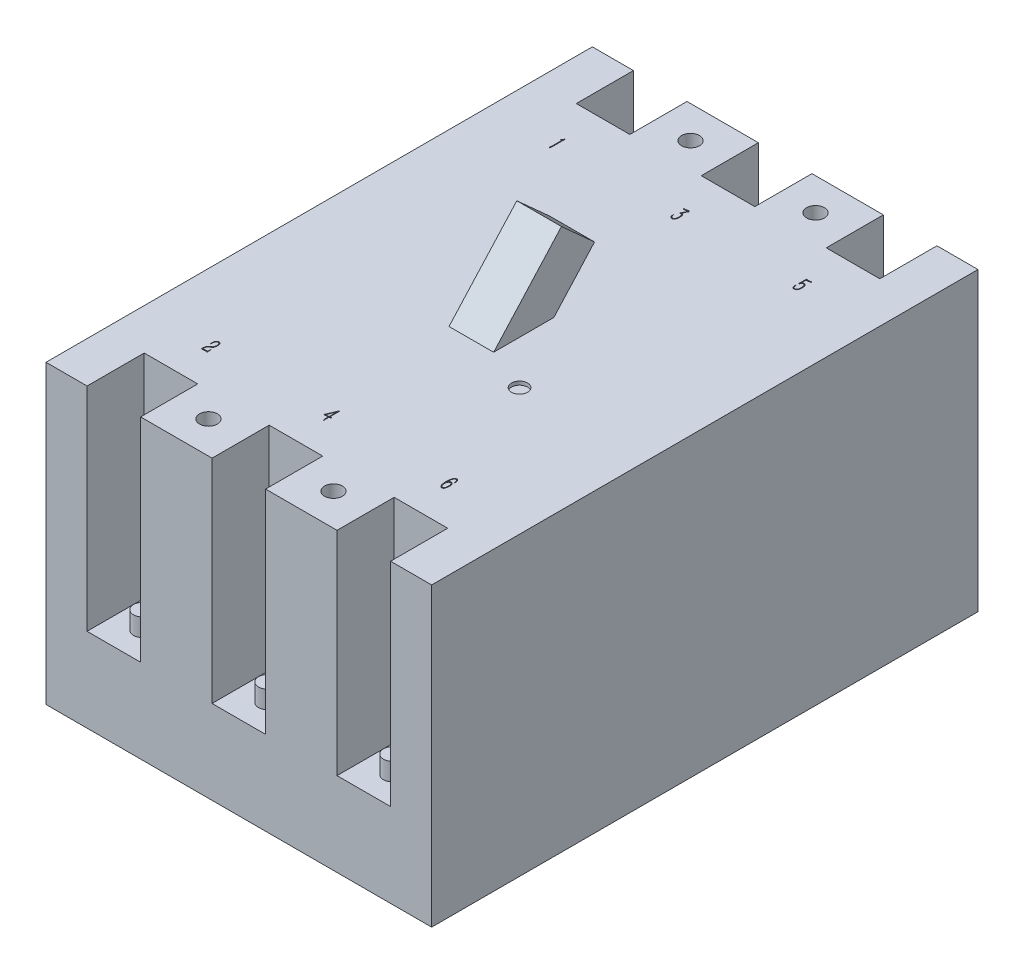
from build123d import *

# Parameters (mm, degrees)
SKETCH_1_W                 = 108
SKETCH_1_H                 = 153
EXTRUDE_1_DEPTH            = 83
SKETCH_31_R                = 2.5
CUT_EXTRUDE_2_DEPTH        = 138.062928959
SKETCH_4_W                 = 7.5
SKETCH_4_H                 = 16
SKETCH_4_W_2               = 15
CUT_EXTRUDE_3_DEPTH        = 59.5
SKETCH_33_R                = 2.5
EXTRUDE_2_DEPTH            = 5
MIRROR_2_COPY_1_SKETCH_W   = 7.5
MIRROR_2_COPY_1_SKETCH_H   = 16
MIRROR_2_COPY_1_SKETCH_W_2 = 15
MIRROR_2_COPY_1_DEPTH      = 59.5
MIRROR_2_COPY_2_SKETCH_R   = 2.5
MIRROR_2_COPY_2_DEPTH      = 5
EXTRUDE_3_DEPTH            = 6.25
CUT_EXTRUDE_4_DEPTH        = 1
SKETCH_37_R                = 2.252237749
CUT_EXTRUDE_6_DEPTH        = 1


with BuildPart() as part:
    # 草图1 → 凸台-拉伸1 (new body)
    with BuildSketch(Plane(origin=(0, 0, 0), x_dir=(1, 0, 0), z_dir=(0, 1, 0))):
        Rectangle(SKETCH_1_W, SKETCH_1_H)
    extrude(amount=EXTRUDE_1_DEPTH)

    # 草图31 → 切除-拉伸2 (cut, through all)
    with BuildSketch(Plane(origin=(-5.579690445, 0, -14.864692202), x_dir=(1, 0, 0), z_dir=(0, -1, 0))):
        with Locations(Location((23.079690445, -52.635307798, 0), (0, 0, 270))):
            Circle(SKETCH_31_R)
        with Locations(Location((-11.920309555, -52.635307798, 0), (0, 0, 270))):
            Circle(SKETCH_31_R)
        with Locations(Location((23.079690445, 82.364692202, 0), (0, 0, 270))):
            Circle(SKETCH_31_R)
        with Locations(Location((-11.920309555, 82.364692202, 0), (0, 0, 270))):
            Circle(SKETCH_31_R)
    extrude(amount=-CUT_EXTRUDE_2_DEPTH, mode=Mode.SUBTRACT)

    # 草图4 → 切除-拉伸3 (cut)
    with BuildSketch(Plane(origin=(0, 83, 0), x_dir=(1, 0, 0), z_dir=(0, 1, 0))):
        with Locations((3.75, 68.5)):
            Rectangle(SKETCH_4_W, SKETCH_4_H)
        with Locations((35, 68.5)):
            Rectangle(SKETCH_4_W_2, SKETCH_4_H)
    cut_extrude_3 = extrude(amount=-CUT_EXTRUDE_3_DEPTH, mode=Mode.SUBTRACT)

    # 草图33 → 凸台-拉伸2 (add)
    with BuildSketch(Plane(origin=(0, 23.5, 0), x_dir=(1, 0, 0), z_dir=(0, 1, 0))):
        with Locations(Location((35, 68.5, 0), (0, 0, 90))):
            Circle(SKETCH_33_R)
        with Locations((0, 68.5)):
            Circle(SKETCH_33_R)
    extrude_2 = extrude(amount=EXTRUDE_2_DEPTH)

    # 镜向1: 切除-拉伸3, 凸台-拉伸2 across plane
    add(cut_extrude_3.mirror(Plane(origin=(0, 0, 0), x_dir=(0, 0, 1), z_dir=(1, 0, 0))), mode=Mode.SUBTRACT)
    add(extrude_2.mirror(Plane(origin=(0, 0, 0), x_dir=(0, 0, 1), z_dir=(1, 0, 0))))

    # 镜向2: 切除-拉伸3, 凸台-拉伸2 across plane
    add(cut_extrude_3.mirror(Plane.XY), mode=Mode.SUBTRACT)
    add(extrude_2.mirror(Plane.XY))

    # 镜向2 copy 1 sketch → 镜向2 copy 1 (cut)
    with BuildSketch(Plane(origin=(0, 83, 0), x_dir=(-1, 0, 0), z_dir=(0, 1, 0))):
        with Locations((3.75, 68.5)):
            Rectangle(MIRROR_2_COPY_1_SKETCH_W, MIRROR_2_COPY_1_SKETCH_H)
        with Locations((35, 68.5)):
            Rectangle(MIRROR_2_COPY_1_SKETCH_W_2, MIRROR_2_COPY_1_SKETCH_H)
    extrude(amount=-MIRROR_2_COPY_1_DEPTH, mode=Mode.SUBTRACT)

    # 镜向2 copy 2 sketch → 镜向2 copy 2 (add)
    with BuildSketch(Plane(origin=(0, 23.5, 0), x_dir=(-1, 0, 0), z_dir=(0, 1, 0))):
        with Locations(Location((35, 68.5, 0), (0, 0, 90))):
            Circle(MIRROR_2_COPY_2_SKETCH_R)
        with Locations((0, 68.5)):
            Circle(MIRROR_2_COPY_2_SKETCH_R)
    extrude(amount=MIRROR_2_COPY_2_DEPTH)

    # 草图34 → 凸台-拉伸3 (add, symmetric)
    with BuildSketch(Plane(origin=(0, 0, 0), x_dir=(0, 0, -1), z_dir=(1, 0, 0))):
        Polygon((-11.393784787, 83), (7.595856524, 104), (16.867328691, 95.61609853), (5.458986509, 83), align=None)
    extrude(amount=EXTRUDE_3_DEPTH, both=True)

    # 草图36 → 切除-拉伸4 (cut)
    with BuildSketch(Plane(origin=(0, 83, 0), x_dir=(1, 0, 0), z_dir=(0, 1, 0))):
        with BuildLine():
            Line((-35.463855228, 50.271863997), (-35.390959416, 50.271863997))
            Line((-35.390959416, 50.271863997), (-35.397854965, 46.740357397))
            add(Edge.make_bspline(
                [(-35.397854965, 46.740357397), (-35.398640498, 46.70850869), (-35.400146669, 46.647442338), (-35.400268907, 46.560072226), (-35.403142299, 46.480966693), (-35.403371164, 46.410012482), (-35.405507773, 46.347302289), (-35.407978554, 46.292822989), (-35.408213325, 46.246472462), (-35.412583696, 46.173927907), (-35.417791571, 46.074184552), (-35.430706832, 45.971450592), (-35.440988352, 45.898248347), (-35.451440364, 45.864925406), (-35.46468199, 45.838559202), (-35.477897108, 45.841633988), (-35.483556799, 45.842950839)],
                knots=[0, 0, 0, 0, 1.45038606, 2.780953852, 3.977268029, 5.053718292, 6.010937745, 6.833690271, 7.536464333, 8.120251454, 10.142880859, 12.069479857, 12.873132744, 13.440417135, 13.76034519, 14, 14, 14, 14], degree=3))
            add(Edge.make_bspline(
                [(-35.483556799, 45.842950839), (-35.484865139, 45.843941163), (-35.490465154, 45.84817999), (-35.50381964, 45.857152029), (-35.519687524, 45.881202111), (-35.526633491, 45.902778266), (-35.53084057, 45.915846651)],
                knots=[0, 0, 0, 0, 0.221265066, 0.947068446, 2.150880552, 4, 4, 4, 4], degree=3))
            Line((-35.53084057, 45.915846651), (-35.563348162, 46.002533564))
            Line((-35.563348162, 46.002533564), (-35.637229053, 46.241907651))
            add(Edge.make_bspline(
                [(-35.637229053, 46.241907651), (-35.646122719, 46.264430286), (-35.661615025, 46.303663554), (-35.677243343, 46.355280368), (-35.689099513, 46.388239883), (-35.692250787, 46.414955004), (-35.677071085, 46.440013858), (-35.665891755, 46.478596853), (-35.648689753, 46.527845507), (-35.632445171, 46.585972264), (-35.618097373, 46.648777307), (-35.60517251, 46.716636181), (-35.597847619, 46.793090567), (-35.594254475, 46.866088454), (-35.591496951, 46.936370115), (-35.590995951, 47.004031777), (-35.589614127, 47.084145254), (-35.589829994, 47.141940196), (-35.589945283, 47.17280688)],
                knots=[0, 0, 0, 0, 1.220359697, 2.125803599, 2.712350858, 2.994193817, 3.439826662, 4.12562012, 5.031064022, 6.063176816, 7.167225426, 8.277459231, 9.542238136, 11.034069985, 11.961482632, 13.08703073, 14.444263491, 16, 16, 16, 16], degree=3))
            Line((-35.589945283, 47.17280688), (-35.584034811, 49.779324722))
            Line((-35.584034811, 49.779324722), (-35.929797382, 49.479860843))
            Line((-35.929797382, 49.479860843), (-35.956394503, 49.593144877))
            add(Edge.make_bspline(
                [(-35.956394503, 49.593144877), (-35.928288885, 49.622186554), (-35.875603746, 49.676626377), (-35.805193046, 49.755009937), (-35.747282709, 49.823034452), (-35.686965228, 49.902558297), (-35.619432928, 50.001525227), (-35.569562455, 50.08283406), (-35.543646591, 50.125087293)],
                knots=[0, 0, 0, 0, 1.077185482, 2.019228619, 2.808185376, 3.45765616, 4.678836699, 6, 6, 6, 6], degree=3))
            Line((-35.543646591, 50.125087293), (-35.463855228, 50.271863997))
        make_face()
        with BuildLine():
            add(Edge.make_bspline(
                [(-1.332996908, 48.655350097), (-1.31824086, 48.685897445), (-1.289815262, 48.744742917), (-1.24835386, 48.829743476), (-1.209674151, 48.907784655), (-1.176591328, 48.98020216), (-1.145743098, 49.045399434), (-1.118268756, 49.104074436), (-1.094529073, 49.156246349), (-1.069536201, 49.214168344), (-1.043614775, 49.274594425), (-1.018520658, 49.333780228), (-1.000271921, 49.376058011), (-0.990837286, 49.398423846), (-0.987234338, 49.406965031)],
                knots=[0, 0, 0, 0, 1.475873638, 2.843077615, 4.114458223, 5.26483622, 6.306479236, 7.252326145, 8.083448402, 8.799989154, 9.996708352, 10.943956596, 11.596712522, 12, 12, 12, 12], degree=3))
            Line((-0.987234338, 49.406965031), (-0.774457371, 49.972400118))
            add(Edge.make_bspline(
                [(-0.774457371, 49.972400118), (-0.820734865, 49.967871333), (-0.921710075, 49.957989748), (-1.050572238, 49.950143748), (-1.157716509, 49.94442999), (-1.231235798, 49.938269385), (-1.295613755, 49.932511244), (-1.33530131, 49.928130482), (-1.353683558, 49.926101426)],
                knots=[0, 0, 0, 0, 1.440114021, 3.142257811, 3.998086789, 4.76330671, 5.427195687, 6, 6, 6, 6], degree=3))
            Line((-1.353683558, 49.926101426), (-1.552669425, 49.892608756))
            add(Edge.make_bspline(
                [(-1.552669425, 49.892608756), (-1.561560651, 49.890739522), (-1.585818346, 49.885639741), (-1.630678314, 49.871713817), (-1.695284952, 49.854588145), (-1.744459411, 49.840504542), (-1.772341941, 49.832518964)],
                knots=[0, 0, 0, 0, 0.478461291, 1.305373098, 2.472113022, 4, 4, 4, 4], degree=3))
            Line((-1.772341941, 49.832518964), (-1.838342204, 49.805921843))
            Line((-1.838342204, 49.805921843), (-2.004820479, 50.052191481))
            add(Edge.make_bspline(
                [(-2.004820479, 50.052191481), (-2.011850302, 50.061833456), (-2.02385096, 50.078293337), (-2.033813644, 50.101190689), (-2.041208813, 50.117098031), (-2.034580743, 50.133116746), (-2.008371403, 50.130714712), (-1.988582953, 50.116665233), (-1.963307571, 50.10314783), (-1.934227678, 50.10124669), (-1.89897255, 50.099177697), (-1.87313363, 50.103193566), (-1.859028854, 50.105385722)],
                knots=[0, 0, 0, 0, 1.323589942, 2.259509366, 2.829398404, 3.190947808, 3.965341466, 5.19662492, 6.050472624, 7.088782, 8.410843841, 10, 10, 10, 10], degree=3))
            Line((-1.859028854, 50.105385722), (-1.646251887, 50.112281272))
            Line((-1.646251887, 50.112281272), (-0.807950042, 50.211774206))
            Line((-0.807950042, 50.211774206), (-0.741949779, 50.271863997))
            Line((-0.741949779, 50.271863997), (-0.688755537, 50.325058239))
            add(Edge.make_bspline(
                [(-0.688755537, 50.325058239), (-0.687105827, 50.323094488), (-0.680342934, 50.315044202), (-0.665783636, 50.295888144), (-0.639895166, 50.265111371), (-0.620322331, 50.239463651), (-0.608964175, 50.224580227)],
                knots=[0, 0, 0, 0, 0.23984028, 0.983211964, 2.249351781, 4, 4, 4, 4], degree=3))
            Line((-0.608964175, 50.224580227), (-0.481889042, 50.064997502))
            add(Edge.make_bspline(
                [(-0.481889042, 50.064997502), (-0.473355746, 50.053918159), (-0.45917476, 50.035506048), (-0.448654159, 50.006059781), (-0.459434557, 49.986109256), (-0.474494123, 49.969008037), (-0.498905759, 49.948468162), (-0.518247228, 49.934175211), (-0.529172812, 49.926101426)],
                knots=[0, 0, 0, 0, 1.419029252, 2.358201718, 2.827787952, 3.596253847, 4.642174893, 6, 6, 6, 6], degree=3))
            Line((-0.529172812, 49.926101426), (-0.602068625, 49.866011635))
            add(Edge.make_bspline(
                [(-0.602068625, 49.866011635), (-0.623371993, 49.812473244), (-0.663792143, 49.710891665), (-0.722029572, 49.566323531), (-0.775319198, 49.437781678), (-0.822111181, 49.324143501), (-0.865090277, 49.226700605), (-0.90057206, 49.144017925), (-0.932517213, 49.077683042), (-0.952056541, 49.038851951), (-0.960637217, 49.021799318)],
                knots=[0, 0, 0, 0, 1.507300768, 2.859891598, 4.076963614, 5.147345159, 6.074452096, 6.862861548, 7.500626815, 8, 8, 8, 8], degree=3))
            Line((-0.960637217, 49.021799318), (-1.160608162, 48.642544076))
            add(Edge.make_bspline(
                [(-1.160608162, 48.642544076), (-1.136970953, 48.644431367), (-1.091701527, 48.648045862), (-1.022614792, 48.654945758), (-0.947340823, 48.645455013), (-0.881319042, 48.619050427), (-0.82514603, 48.58646919), (-0.780134585, 48.553926938), (-0.737132938, 48.511631119), (-0.693284476, 48.461909292), (-0.649333585, 48.402563713), (-0.608931526, 48.33068403), (-0.566873499, 48.248603861), (-0.51427509, 48.123514998), (-0.45744027, 47.956143546), (-0.422908357, 47.745924068), (-0.405846949, 47.535305771), (-0.403342212, 47.395138948), (-0.402097679, 47.325494056)],
                knots=[0, 0, 0, 0, 0.660541429, 1.265053373, 1.928435853, 2.750244091, 3.225390118, 3.735570922, 4.291687282, 4.900607759, 5.580848831, 6.342918567, 7.193367346, 8.147740655, 10.119512469, 12.097611575, 14.061014616, 16, 16, 16, 16], degree=3))
            add(Edge.make_bspline(
                [(-0.402097679, 47.325494056), (-0.404726648, 47.270969543), (-0.409720845, 47.167390476), (-0.421790637, 47.021025307), (-0.439802287, 46.892617688), (-0.466033174, 46.747849231), (-0.512293263, 46.587908576), (-0.569441733, 46.44034855), (-0.623703344, 46.33403995), (-0.669433819, 46.263547372), (-0.719521734, 46.200482752), (-0.773347731, 46.145294374), (-0.829337874, 46.099941108), (-0.883678867, 46.060935813), (-0.938666436, 46.033368138), (-1.009852767, 46.010338071), (-1.096844164, 45.994463304), (-1.16612907, 45.991282865), (-1.200011304, 45.989727543)],
                knots=[0, 0, 0, 0, 1.512752116, 2.8737433, 4.067977017, 5.104892351, 6.948544146, 8.672095895, 9.482011449, 10.251829035, 10.996496654, 11.710742831, 12.38300564, 12.991319199, 13.561044299, 14.079002633, 15.060579187, 16, 16, 16, 16], degree=3))
            add(Edge.make_bspline(
                [(-1.200011304, 45.989727543), (-1.228911408, 45.989234927), (-1.284511892, 45.988287192), (-1.365158936, 45.994852477), (-1.438610662, 46.009879213), (-1.507496182, 46.030320787), (-1.572009705, 46.062646769), (-1.633632597, 46.108824313), (-1.695667091, 46.165686645), (-1.755145754, 46.235467117), (-1.809581437, 46.315412429), (-1.857178565, 46.403842866), (-1.896725225, 46.499506512), (-1.936039594, 46.635649033), (-1.969361855, 46.809735263), (-1.975298306, 46.95067488), (-1.978223358, 47.020119705)],
                knots=[0, 0, 0, 0, 0.828828519, 1.594571005, 2.314948186, 2.97625877, 3.650192192, 4.371738268, 5.178272596, 6.059897072, 6.995131469, 7.947518938, 8.935744196, 9.957858231, 12.008325587, 14, 14, 14, 14], degree=3))
            Line((-1.978223358, 47.020119705), (-1.985118908, 47.279195364))
            Line((-1.985118908, 47.279195364), (-1.912223095, 47.279195364))
            add(Edge.make_bspline(
                [(-1.912223095, 47.279195364), (-1.906648849, 47.240776505), (-1.895973673, 47.167200983), (-1.880445403, 47.061050202), (-1.864362325, 46.964286574), (-1.846237148, 46.849776063), (-1.816050244, 46.721193109), (-1.765194515, 46.582804286), (-1.696227024, 46.46587446), (-1.615250698, 46.36951626), (-1.52054406, 46.299574509), (-1.419159036, 46.255456704), (-1.315829395, 46.234626171), (-1.247366821, 46.23488514), (-1.213802404, 46.235012101)],
                knots=[0, 0, 0, 0, 0.994021113, 1.903638599, 2.746793397, 3.505624798, 4.871908371, 6.122639036, 7.264652637, 8.331625701, 9.323760524, 10.250011688, 11.142051883, 12, 12, 12, 12], degree=3))
            add(Edge.make_bspline(
                [(-1.213802404, 46.235012101), (-1.186800334, 46.237340561), (-1.133914514, 46.241901044), (-1.057224335, 46.259263285), (-0.986301345, 46.288888617), (-0.920002445, 46.326772965), (-0.860326821, 46.376175459), (-0.806618438, 46.434387727), (-0.761134308, 46.503542507), (-0.71015941, 46.609414479), (-0.660619633, 46.755372977), (-0.623344885, 46.940765815), (-0.599089597, 47.129871431), (-0.587694594, 47.318030592), (-0.586141966, 47.503400035), (-0.601384421, 47.624718565), (-0.608964175, 47.685047726)],
                knots=[0, 0, 0, 0, 0.647840119, 1.268849254, 1.871153999, 2.479976942, 3.088343857, 3.716462885, 4.367721208, 5.059616847, 6.52246665, 8.039623249, 9.575767262, 11.078710543, 12.547304005, 14, 14, 14, 14], degree=3))
            add(Edge.make_bspline(
                [(-0.608964175, 47.685047726), (-0.619562912, 47.750073671), (-0.640514176, 47.878614997), (-0.688978495, 48.032902255), (-0.736702332, 48.148112138), (-0.779280281, 48.225408799), (-0.827540526, 48.294453007), (-0.882207105, 48.352361404), (-0.937623681, 48.399881624), (-0.993247145, 48.431590681), (-1.048178248, 48.447907478), (-1.083376846, 48.444320143), (-1.100518371, 48.442573131)],
                knots=[0, 0, 0, 0, 2.019199264, 3.991492233, 4.943861116, 5.841091039, 6.693606335, 7.520378909, 8.278781735, 8.923571305, 9.475785111, 10, 10, 10, 10], degree=3))
            Line((-1.100518371, 48.442573131), (-1.206906854, 48.42976711))
            Line((-1.206906854, 48.42976711), (-1.253205546, 48.343080197))
            add(Edge.make_bspline(
                [(-1.253205546, 48.343080197), (-1.259385174, 48.332276849), (-1.270157784, 48.313443961), (-1.284878439, 48.288551126), (-1.296635643, 48.273970818), (-1.305559628, 48.261401523), (-1.318459991, 48.265629851), (-1.326757526, 48.280078585), (-1.3400219, 48.301349147), (-1.348650254, 48.319617455), (-1.353683558, 48.330274176)],
                knots=[0, 0, 0, 0, 1.659028505, 2.892093886, 3.763458346, 4.288089223, 4.647361994, 5.327919393, 6.441255868, 8, 8, 8, 8], degree=3))
            Line((-1.353683558, 48.330274176), (-1.460072041, 48.536155593))
            add(Edge.make_bspline(
                [(-1.460072041, 48.536155593), (-1.467762008, 48.547988328), (-1.481167812, 48.568616159), (-1.475356033, 48.592130175), (-1.472878062, 48.602155856)],
                knots=[0, 0, 0, 0, 1.147259222, 2, 2, 2, 2], degree=3))
            Line((-1.472878062, 48.602155856), (-1.419683821, 48.622842505))
            Line((-1.419683821, 48.622842505), (-1.332996908, 48.655350097))
        make_face()
        with BuildLine():
            add(Edge.make_bspline(
                [(32.518099103, 50.03248991), (32.53358809, 50.034123241), (32.56042479, 50.036953203), (32.586756348, 50.042816624), (32.597890466, 50.045295931)],
                knots=[0, 0, 0, 0, 1.154313806, 2, 2, 2, 2], degree=3))
            Line((32.597890466, 50.045295931), (32.73777162, 50.052191481))
            Line((32.73777162, 50.052191481), (32.996847278, 50.091594623))
            Line((32.996847278, 50.091594623), (33.216519795, 50.118191743))
            add(Edge.make_bspline(
                [(33.216519795, 50.118191743), (33.23704136, 50.121509448), (33.280170582, 50.128482115), (33.321136278, 50.143704881), (33.342609849, 50.151684414)],
                knots=[0, 0, 0, 0, 0.951631555, 2, 2, 2, 2], degree=3))
            Line((33.342609849, 50.151684414), (33.442102783, 50.192072635))
            add(Edge.make_bspline(
                [(33.442102783, 50.192072635), (33.452340172, 50.195871744), (33.470301405, 50.202537181), (33.493217179, 50.213018793), (33.50971844, 50.219720396), (33.518609614, 50.223269234), (33.521894145, 50.224580227)],
                knots=[0, 0, 0, 0, 1.520021181, 2.666837392, 3.507509911, 4, 4, 4, 4], degree=3))
            Line((33.521894145, 50.224580227), (33.581983937, 50.264968447))
            Line((33.581983937, 50.264968447), (33.775059333, 50.071893052))
            add(Edge.make_bspline(
                [(33.775059333, 50.071893052), (33.782294889, 50.062227227), (33.794962128, 50.045305334), (33.79965252, 50.016324191), (33.793467356, 49.995265167), (33.78641201, 49.976731265), (33.766479612, 49.965565681), (33.750897282, 49.965527457), (33.741566662, 49.965504568)],
                knots=[0, 0, 0, 0, 1.452844315, 2.54348448, 3.406058373, 4.120848162, 4.874773518, 6, 6, 6, 6], degree=3))
            Line((33.741566662, 49.965504568), (32.504308004, 49.793115822))
            Line((32.504308004, 49.793115822), (32.484606433, 48.442573131))
            add(Edge.make_bspline(
                [(32.484606433, 48.442573131), (32.50978426, 48.47318708), (32.556228095, 48.529658559), (32.625254383, 48.610545492), (32.705471798, 48.679259807), (32.787820269, 48.723627751), (32.865033057, 48.755100064), (32.933444858, 48.771121004), (33.009018254, 48.781198048), (33.061825504, 48.782003805), (33.089444662, 48.78242523)],
                knots=[0, 0, 0, 0, 1.30943776, 2.415431215, 3.508265892, 4.775479805, 5.486396256, 6.257089544, 7.088425914, 8, 8, 8, 8], degree=3))
            add(Edge.make_bspline(
                [(33.089444662, 48.78242523), (33.116758479, 48.780655331), (33.168386924, 48.777309875), (33.240371885, 48.764586897), (33.302877274, 48.746671535), (33.374208067, 48.709955743), (33.457550996, 48.646383591), (33.536117538, 48.568676253), (33.597269505, 48.493379266), (33.642355, 48.428680001), (33.679839045, 48.354669005), (33.715600145, 48.2749978), (33.747458473, 48.187593681), (33.773761602, 48.091692419), (33.795266776, 47.987355976), (33.817362017, 47.833716507), (33.836894968, 47.625758514), (33.839632696, 47.454921968), (33.841059595, 47.365882276)],
                knots=[0, 0, 0, 0, 0.737858689, 1.39469691, 1.969129469, 2.484137971, 3.548991738, 4.782985237, 5.456749125, 6.164369648, 6.905359031, 7.690566505, 8.520047268, 9.411980184, 10.370982938, 11.392008999, 13.598323608, 16, 16, 16, 16], degree=3))
            add(Edge.make_bspline(
                [(33.841059595, 47.365882276), (33.839466481, 47.326149759), (33.836384756, 47.249291083), (33.831124341, 47.137873383), (33.822017597, 47.034432378), (33.807999132, 46.910043336), (33.786279251, 46.767552138), (33.748137976, 46.609517829), (33.695606461, 46.463896974), (33.62543521, 46.332767124), (33.546037814, 46.21823091), (33.461061306, 46.126696955), (33.373353011, 46.060129533), (33.279908223, 46.018196839), (33.177890759, 45.999464738), (33.10723839, 45.996964757), (33.069743091, 45.995638014)],
                knots=[0, 0, 0, 0, 0.953497838, 1.844448518, 2.674189816, 3.442807412, 4.845957472, 6.127295929, 7.335424679, 8.547012004, 9.682888764, 10.668703604, 11.530079681, 12.305522429, 13.100738679, 14, 14, 14, 14], degree=3))
            add(Edge.make_bspline(
                [(33.069743091, 45.995638014), (33.024753156, 45.994860363), (32.94130992, 45.993418047), (32.821377605, 46.007758352), (32.712583445, 46.047129539), (32.609115822, 46.107254371), (32.512432837, 46.191954607), (32.429166668, 46.2956999), (32.362724281, 46.407847287), (32.314596949, 46.524874595), (32.285145759, 46.651220386), (32.260028435, 46.788786537), (32.243192541, 46.934358152), (32.244565939, 47.032559691), (32.245232345, 47.080209497)],
                knots=[0, 0, 0, 0, 1.038316962, 1.925775792, 2.769505923, 3.689817589, 4.672983852, 5.718137725, 6.747565775, 7.672204827, 8.626195073, 9.735182009, 10.901054531, 12, 12, 12, 12], degree=3))
            Line((32.245232345, 47.080209497), (32.252127895, 47.266389343))
            Line((32.252127895, 47.266389343), (32.325023708, 47.266389343))
            add(Edge.make_bspline(
                [(32.325023708, 47.266389343), (32.328058338, 47.229263947), (32.334059271, 47.155849082), (32.347473694, 47.045829854), (32.369284997, 46.934172952), (32.395862871, 46.821204569), (32.430820571, 46.714632342), (32.468051649, 46.616280258), (32.52129409, 46.526770422), (32.586006518, 46.437243366), (32.669314465, 46.354606816), (32.752320448, 46.297351273), (32.82825101, 46.264679358), (32.893132955, 46.246760986), (32.965721219, 46.237578105), (33.016526208, 46.235894331), (33.04314597, 46.235012101)],
                knots=[0, 0, 0, 0, 1.11825376, 2.211328589, 3.324923754, 4.532299777, 5.691974021, 6.691431964, 7.680579644, 8.808308283, 10.000254076, 11.186807161, 11.80939407, 12.474247533, 13.200567339, 14, 14, 14, 14], degree=3))
            add(Edge.make_bspline(
                [(33.04314597, 46.235012101), (33.074424497, 46.235140402), (33.137537078, 46.235399281), (33.216842227, 46.254221166), (33.279280533, 46.283899056), (33.327673726, 46.318694296), (33.37822462, 46.362911207), (33.427039564, 46.418973517), (33.474612129, 46.481314026), (33.516547345, 46.549659222), (33.550075109, 46.623250726), (33.58542269, 46.72921835), (33.618263387, 46.872762414), (33.648372793, 47.057560677), (33.664052822, 47.259557562), (33.662552501, 47.399682637), (33.661775299, 47.47227076)],
                knots=[0, 0, 0, 0, 0.849390509, 1.713866746, 2.18933602, 2.722107664, 3.329685584, 4.012931591, 4.740083059, 5.461671267, 6.189151886, 6.934940173, 8.497098365, 10.188936476, 12.025778447, 14, 14, 14, 14], degree=3))
            add(Edge.make_bspline(
                [(33.661775299, 47.47227076), (33.659565655, 47.514662466), (33.655345264, 47.595630053), (33.642752968, 47.711143529), (33.629849346, 47.815144123), (33.607558963, 47.936746957), (33.571403209, 48.075822043), (33.519638249, 48.20484513), (33.469544547, 48.297998078), (33.428491162, 48.359797426), (33.381549272, 48.412587403), (33.330384419, 48.457244217), (33.274845702, 48.49284533), (33.216352141, 48.519994501), (33.15404771, 48.537207889), (33.111218604, 48.541081721), (33.089444662, 48.543051143)],
                knots=[0, 0, 0, 0, 1.343436322, 2.565945237, 3.677305729, 4.659990038, 6.477828082, 8.216935171, 9.044830502, 9.823221578, 10.559528994, 11.274319052, 11.966299338, 12.640726254, 13.308957145, 14, 14, 14, 14], degree=3))
            add(Edge.make_bspline(
                [(33.089444662, 48.543051143), (33.065755084, 48.542326077), (33.019704733, 48.540916615), (32.952635191, 48.529009606), (32.890503127, 48.508171393), (32.816116839, 48.471611734), (32.734612662, 48.417675138), (32.655399404, 48.343792401), (32.593361455, 48.26894064), (32.564948495, 48.21551025), (32.551591774, 48.190393022)],
                knots=[0, 0, 0, 0, 0.840347904, 1.633558669, 2.40744423, 3.157989381, 4.570423979, 5.856859538, 6.992525654, 8, 8, 8, 8], degree=3))
            Line((32.551591774, 48.190393022), (32.504308004, 48.09681056))
            Line((32.504308004, 48.09681056), (32.491501983, 48.011108726))
            add(Edge.make_bspline(
                [(32.491501983, 48.011108726), (32.490744979, 47.999337256), (32.489416008, 47.978671655), (32.484935561, 47.951141923), (32.482215074, 47.934172577), (32.479911421, 47.918807611), (32.464712904, 47.92067294), (32.44996839, 47.934490077), (32.4236479, 47.955719158), (32.403696379, 47.973875731), (32.392009049, 47.984511605)],
                knots=[0, 0, 0, 0, 1.417361355, 2.488272572, 3.242975776, 3.665551287, 3.979432497, 4.77388376, 6.110184861, 8, 8, 8, 8], degree=3))
            Line((32.392009049, 47.984511605), (32.252127895, 48.09681056))
            add(Edge.make_bspline(
                [(32.252127895, 48.09681056), (32.240138579, 48.107715116), (32.221527538, 48.124642281), (32.20108047, 48.15670327), (32.216294291, 48.190571267), (32.229814388, 48.211005164), (32.238336795, 48.223885693)],
                knots=[0, 0, 0, 0, 1.303116375, 2.022830373, 2.753688992, 4, 4, 4, 4], degree=3))
            Line((32.238336795, 48.223885693), (32.312217687, 48.323378626))
            Line((32.312217687, 48.323378626), (32.325023708, 49.034605339))
            Line((32.325023708, 49.034605339), (32.331919257, 49.546846185))
            add(Edge.make_bspline(
                [(32.331919257, 49.546846185), (32.331920027, 49.565891051), (32.331921684, 49.606936023), (32.331907188, 49.672607648), (32.331972658, 49.746489796), (32.331700483, 49.824634136), (32.332642712, 49.8998565), (32.329969346, 49.963858635), (32.328753654, 50.01318632), (32.326122028, 50.04070602), (32.325023708, 50.052191481)],
                knots=[0, 0, 0, 0, 0.904131945, 1.948560225, 3.117696361, 4.41154035, 5.658618894, 6.687930963, 7.452402571, 8, 8, 8, 8], degree=3))
            Line((32.325023708, 50.052191481), (32.298426587, 50.258072898))
            Line((32.298426587, 50.258072898), (32.365411928, 50.284670018))
            add(Edge.make_bspline(
                [(32.365411928, 50.284670018), (32.375168493, 50.260030344), (32.391572525, 50.218602848), (32.414607787, 50.163274986), (32.443648162, 50.121682227), (32.465878017, 50.09818933), (32.477710883, 50.085684151)],
                knots=[0, 0, 0, 0, 1.37928148, 2.31903137, 3.105226912, 4, 4, 4, 4], degree=3))
            Line((32.477710883, 50.085684151), (32.518099103, 50.03248991))
        make_face()
    extrude(amount=-CUT_EXTRUDE_4_DEPTH, mode=Mode.SUBTRACT)

    # 草图37 → 切除-拉伸6 (cut)
    # profile 1 of 4: a face of its own
    with BuildSketch(Plane(origin=(0, 83, 0), x_dir=(1, 0, 0), z_dir=(0, 1, 0))):
        with Locations(Location((18.452314292, -16.343478373, 0), (0, 0, 270))):
            Circle(SKETCH_37_R)
    # profile 2 of 4: a face of its own
    with BuildSketch(Plane(origin=(0, 83, 0), x_dir=(1, 0, 0), z_dir=(0, 1, 0))):
        with BuildLine():
            Line((-35.384268471, -48.977804096), (-35.484746483, -48.977804096))
            add(Edge.make_bspline(
                [(-35.484746483, -48.977804096), (-35.486816788, -48.945959396), (-35.490763661, -48.885249996), (-35.494836294, -48.798550386), (-35.496556187, -48.720704736), (-35.498279126, -48.625801767), (-35.495621921, -48.506117127), (-35.488487104, -48.409715778), (-35.484746483, -48.359174767)],
                knots=[0, 0, 0, 0, 0.927540379, 1.768282303, 2.522502339, 3.190652681, 4.527123766, 6, 6, 6, 6], degree=3))
            add(Edge.make_bspline(
                [(-35.484746483, -48.359174767), (-35.48215774, -48.32170718), (-35.477151408, -48.249249161), (-35.463938945, -48.144819481), (-35.44864812, -48.04804826), (-35.4287686, -47.957027781), (-35.401908093, -47.867955151), (-35.363669256, -47.778363435), (-35.315978221, -47.685184014), (-35.259632531, -47.5916785), (-35.197808003, -47.503448543), (-35.128412535, -47.431650793), (-35.055784535, -47.376926412), (-34.978510068, -47.344357066), (-34.904315385, -47.324103579), (-34.836655914, -47.308172054), (-34.77585512, -47.297038071), (-34.737441206, -47.295849834), (-34.71934045, -47.295289933)],
                knots=[0, 0, 0, 0, 1.238521709, 2.395159043, 3.470603583, 4.46912877, 5.466066804, 6.534123646, 7.677244524, 8.916145015, 10.13365226, 11.221244199, 12.198275335, 13.109907183, 13.966820176, 14.733954848, 15.403435577, 16, 16, 16, 16], degree=3))
            add(Edge.make_bspline(
                [(-34.71934045, -47.295289933), (-34.696272875, -47.296990767), (-34.650692059, -47.300351563), (-34.583643941, -47.315923052), (-34.518889222, -47.338374814), (-34.43606575, -47.378370168), (-34.339217031, -47.441077368), (-34.256824574, -47.523422307), (-34.199811333, -47.598798329), (-34.159651096, -47.662949152), (-34.124062788, -47.734582465), (-34.079370384, -47.838668107), (-34.032615915, -47.976790702), (-33.998898981, -48.151240495), (-33.977280515, -48.332398841), (-33.967389377, -48.517597226), (-33.965550227, -48.700970271), (-33.976317441, -48.820563197), (-33.981516617, -48.878311162)],
                knots=[0, 0, 0, 0, 0.570779476, 1.127842599, 1.694919432, 2.261066821, 3.397481896, 4.527710891, 5.118384485, 5.730727279, 6.394748858, 7.092559246, 8.529363642, 9.986910621, 11.474321506, 13.03467297, 14.568129345, 16, 16, 16, 16], degree=3))
            add(Edge.make_bspline(
                [(-33.981516617, -48.878311162), (-33.992056171, -48.937712738), (-34.01329253, -49.057402171), (-34.059033138, -49.201506597), (-34.10169144, -49.311063099), (-34.137356019, -49.384477115), (-34.17546327, -49.449468975), (-34.230566126, -49.52632829), (-34.314715385, -49.613572204), (-34.392693403, -49.672078982), (-34.433667671, -49.702821908)],
                knots=[0, 0, 0, 0, 1.490916612, 3.004077927, 3.729534125, 4.397912905, 5.020560084, 5.590839424, 6.734084393, 8, 8, 8, 8], degree=3))
            Line((-34.433667671, -49.702821908), (-34.759728671, -49.908703325))
            add(Edge.make_bspline(
                [(-34.759728671, -49.908703325), (-34.801278643, -49.936911078), (-34.880065318, -49.990398362), (-34.985267282, -50.077767325), (-35.073566739, -50.16982537), (-35.140308074, -50.271614332), (-35.1921447, -50.376391782), (-35.238173974, -50.481598586), (-35.272923736, -50.597560698), (-35.297639118, -50.701500803), (-35.31449419, -50.788794854), (-35.322937234, -50.849675587), (-35.329796063, -50.903482724), (-35.330665993, -50.937107354), (-35.33107423, -50.952886587)],
                knots=[0, 0, 0, 0, 1.453572249, 2.75625039, 3.953730064, 5.132566341, 6.263730064, 7.337486329, 8.453238547, 9.76321854, 10.430854957, 11.026567013, 11.543191201, 12, 12, 12, 12], degree=3))
            Line((-35.33107423, -50.952886587), (-35.344865329, -51.231663817))
            Line((-35.344865329, -51.231663817), (-34.154890441, -51.192260675))
            add(Edge.make_bspline(
                [(-34.154890441, -51.192260675), (-34.139621053, -51.191406924), (-34.11280194, -51.189907399), (-34.087027126, -51.161808455), (-34.08128995, -51.127499624), (-34.071109689, -51.085300748), (-34.063541362, -51.024812425), (-34.057702927, -50.978812049), (-34.054412429, -50.952886587)],
                knots=[0, 0, 0, 0, 0.925905201, 1.626257371, 2.181371879, 3.087088273, 4.358305093, 6, 6, 6, 6], degree=3))
            Line((-34.054412429, -50.952886587), (-34.027815309, -50.3736604))
            Line((-34.027815309, -50.3736604), (-33.935217925, -50.3736604))
            Line((-33.935217925, -50.3736604), (-33.901725254, -51.251365388))
            add(Edge.make_bspline(
                [(-33.901725254, -51.251365388), (-33.900605576, -51.268428929), (-33.898647258, -51.298273081), (-33.897693975, -51.33775258), (-33.897666993, -51.365242792), (-33.898082756, -51.38743835), (-33.905231445, -51.406844344), (-33.911874014, -51.429361685), (-33.937786056, -51.442082922), (-33.975032777, -51.446153158), (-34.031639511, -51.45191771), (-34.076067408, -51.451549018), (-34.1016962, -51.451336333)],
                knots=[0, 0, 0, 0, 1.385018147, 2.4223982, 3.193529914, 3.619812046, 4.200562765, 4.878496499, 5.402948042, 6.404258339, 7.925751149, 10, 10, 10, 10], degree=3))
            Line((-34.1016962, -51.451336333), (-35.424656692, -51.484829004))
            add(Edge.make_bspline(
                [(-35.424656692, -51.484829004), (-35.440738616, -51.484876051), (-35.472437276, -51.484968785), (-35.504920922, -51.453448063), (-35.518556888, -51.414860573), (-35.525381634, -51.369473941), (-35.529953012, -51.309260908), (-35.53214882, -51.20569819), (-35.527454252, -51.058344357), (-35.516879873, -50.936754306), (-35.511343604, -50.873095225)],
                knots=[0, 0, 0, 0, 0.556373901, 1.096654043, 1.476064089, 2.012759395, 2.73145082, 3.635924119, 5.715166189, 8, 8, 8, 8], degree=3))
            add(Edge.make_bspline(
                [(-35.511343604, -50.873095225), (-35.506430625, -50.835937505), (-35.496966521, -50.764358837), (-35.477723783, -50.661325), (-35.457207904, -50.565686534), (-35.434942761, -50.477501301), (-35.410363137, -50.397233881), (-35.383534547, -50.324976165), (-35.355722578, -50.259564412), (-35.313947559, -50.185566601), (-35.260854761, -50.104906496), (-35.20046462, -50.017935485), (-35.142320675, -49.944160713), (-35.066323705, -49.862996572), (-34.963438357, -49.774405104), (-34.87700812, -49.709536234), (-34.832624484, -49.676224787)],
                knots=[0, 0, 0, 0, 1.103491021, 2.125706759, 3.085324024, 3.98349739, 4.803138144, 5.555704107, 6.252741852, 6.89323317, 8.054555834, 9.09539633, 10.010480884, 10.817709087, 12.365830683, 14, 14, 14, 14], degree=3))
            Line((-34.832624484, -49.676224787), (-34.559757725, -49.502850963))
            add(Edge.make_bspline(
                [(-34.559757725, -49.502850963), (-34.537911822, -49.488326478), (-34.495989802, -49.460454172), (-34.438086588, -49.416079198), (-34.388721927, -49.370037007), (-34.34618107, -49.320351469), (-34.307670968, -49.262858257), (-34.276044136, -49.191193868), (-34.242608839, -49.106780118), (-34.203625137, -48.975448095), (-34.163430125, -48.802101373), (-34.1480216, -48.587924669), (-34.156252973, -48.370970372), (-34.181417832, -48.226971329), (-34.194293583, -48.15329335)],
                knots=[0, 0, 0, 0, 0.635613896, 1.219735276, 1.765761318, 2.268061313, 2.802129131, 3.435697723, 4.161225462, 5.001884758, 6.75303811, 8.46119913, 10.189351173, 12, 12, 12, 12], degree=3))
            add(Edge.make_bspline(
                [(-34.194293583, -48.15329335), (-34.203995681, -48.115732349), (-34.222917992, -48.042475924), (-34.258732486, -47.936947188), (-34.305092154, -47.840834152), (-34.354713194, -47.751049817), (-34.416878977, -47.672457503), (-34.499684737, -47.616012587), (-34.597508507, -47.578280464), (-34.669064129, -47.571636055), (-34.706534429, -47.568156691)],
                knots=[0, 0, 0, 0, 1.101106684, 2.147523679, 3.156537618, 4.125318695, 5.058520457, 5.968677808, 6.93629249, 8, 8, 8, 8], degree=3))
            add(Edge.make_bspline(
                [(-34.706534429, -47.568156691), (-34.726257879, -47.567954764), (-34.765597681, -47.567552007), (-34.82419258, -47.576437761), (-34.881184192, -47.595068764), (-34.956047857, -47.628836425), (-35.042554325, -47.691736438), (-35.133608892, -47.786640638), (-35.208714431, -47.902520732), (-35.266539943, -48.036804624), (-35.310020423, -48.189790586), (-35.345318061, -48.361246287), (-35.368495507, -48.553345993), (-35.37497089, -48.687801352), (-35.378358, -48.758131579)],
                knots=[0, 0, 0, 0, 0.469335518, 0.936122588, 1.403629858, 1.893624907, 2.887406355, 3.927357629, 5.011993806, 6.157121359, 7.396943717, 8.794309501, 10.323183677, 12, 12, 12, 12], degree=3))
            Line((-35.378358, -48.758131579), (-35.384268471, -48.977804096))
        make_face()
    # profile 3 of 4: a face of its own
    with BuildSketch(Plane(origin=(0, 83, 0), x_dir=(1, 0, 0), z_dir=(0, 1, 0))):
        with BuildLine():
            Line((-1.211435685, -50.247570346), (-2.149230465, -50.300764588))
            Line((-2.149230465, -50.300764588), (-2.215230727, -50.400257521))
            add(Edge.make_bspline(
                [(-2.215230727, -50.400257521), (-2.219537618, -50.410683646), (-2.226046665, -50.426440752), (-2.250112266, -50.442690901), (-2.268166249, -50.419381447), (-2.276697515, -50.404180177), (-2.282216069, -50.39434705)],
                knots=[0, 0, 0, 0, 1.282902353, 1.938863145, 2.666728425, 4, 4, 4, 4], degree=3))
            Line((-2.282216069, -50.39434705), (-2.408306123, -50.141181863))
            add(Edge.make_bspline(
                [(-2.408306123, -50.141181863), (-2.413700195, -50.126232022), (-2.422594963, -50.10157989), (-2.429070684, -50.068490733), (-2.427229466, -50.045153505), (-2.422955921, -50.033098734), (-2.421112144, -50.027897829)],
                knots=[0, 0, 0, 0, 1.63130738, 2.690008936, 3.434818089, 4, 4, 4, 4], degree=3))
            Line((-2.421112144, -50.027897829), (-2.367917903, -50.015091808))
            Line((-2.367917903, -50.015091808), (-2.29502209, -49.974703588))
            Line((-2.29502209, -49.974703588), (-1.171047465, -47.261797262))
            Line((-1.171047465, -47.261797262), (-1.02525584, -47.261797262))
            Line((-1.02525584, -47.261797262), (-1.02525584, -50.001300709))
            add(Edge.make_bspline(
                [(-1.02525584, -50.001300709), (-1.011556587, -50.00140457), (-0.988262648, -50.001581174), (-0.967020188, -49.992312443), (-0.958270498, -49.988494687)],
                knots=[0, 0, 0, 0, 1.176207474, 2, 2, 2, 2], degree=3))
            Line((-0.958270498, -49.988494687), (-0.858777565, -49.948106467))
            add(Edge.make_bspline(
                [(-0.858777565, -49.948106467), (-0.8459156, -49.943306049), (-0.822989557, -49.934749457), (-0.793469311, -49.921899019), (-0.772571805, -49.912004766), (-0.762834561, -49.904532102), (-0.759284631, -49.901807775)],
                knots=[0, 0, 0, 0, 1.495147538, 2.665053038, 3.513315187, 4, 4, 4, 4], degree=3))
            Line((-0.759284631, -49.901807775), (-0.712985939, -49.862404633))
            Line((-0.712985939, -49.862404633), (-0.526806094, -50.05449495))
            add(Edge.make_bspline(
                [(-0.526806094, -50.05449495), (-0.517321407, -50.065909105), (-0.501795361, -50.084593612), (-0.495018899, -50.116213396), (-0.501481251, -50.137596911), (-0.513561786, -50.152996075), (-0.534619393, -50.159451003), (-0.550119406, -50.160350105), (-0.559313686, -50.160883434)],
                knots=[0, 0, 0, 0, 1.690587597, 2.767423091, 3.557953073, 4.202677464, 4.933866242, 6, 6, 6, 6], degree=3))
            Line((-0.559313686, -50.160883434), (-1.02525584, -50.214077675))
            Line((-1.02525584, -50.214077675), (-1.02525584, -51.405037642))
            add(Edge.make_bspline(
                [(-1.02525584, -51.405037642), (-1.025279553, -51.40865006), (-1.025359357, -51.420807237), (-1.023829237, -51.446399645), (-1.023208781, -51.487121514), (-1.022410361, -51.537723555), (-1.021042987, -51.588498874), (-1.021484769, -51.6296242), (-1.024150455, -51.655558246), (-1.0304201, -51.672225173), (-1.042692733, -51.675209502), (-1.048992044, -51.672320795), (-1.05185296, -51.67100885)],
                knots=[0, 0, 0, 0, 0.375701713, 1.264380521, 2.665139726, 4.612257271, 6.525225464, 7.960129458, 8.858599367, 9.286556546, 9.675980055, 10, 10, 10, 10], degree=3))
            add(Edge.make_bspline(
                [(-1.05185296, -51.67100885), (-1.057414868, -51.667702925), (-1.074181438, -51.657737095), (-1.088876102, -51.625576279), (-1.106532696, -51.592195251), (-1.114470173, -51.568026035), (-1.117853223, -51.557724817)],
                knots=[0, 0, 0, 0, 0.572299195, 1.725216547, 3.030459198, 4, 4, 4, 4], degree=3))
            Line((-1.117853223, -51.557724817), (-1.177943015, -51.437545234))
            Line((-1.177943015, -51.437545234), (-1.211435685, -51.34494785))
            add(Edge.make_bspline(
                [(-1.211435685, -51.34494785), (-1.216528971, -51.33385142), (-1.225745373, -51.313772209), (-1.235841372, -51.286094368), (-1.244855544, -51.265660731), (-1.249873497, -51.241350933), (-1.243987287, -51.203374701), (-1.231014423, -51.15019247), (-1.215434698, -51.093339283), (-1.208114758, -51.041388178), (-1.205109704, -50.996602119), (-1.204732711, -50.967667123), (-1.204540136, -50.952886587)],
                knots=[0, 0, 0, 0, 0.908031708, 1.643101311, 2.192199313, 2.565975908, 3.473020803, 5.002279505, 6.661670863, 7.846934984, 8.900174221, 10, 10, 10, 10], degree=3))
            Line((-1.204540136, -50.952886587), (-1.211435685, -50.247570346))
        make_face()
        Polygon((-1.204540136, -50.027897829), (-1.204540136, -47.8203368), (-2.142334915, -50.0751816), align=None, mode=Mode.SUBTRACT)
    # profile 4 of 4: a face of its own
    with BuildSketch(Plane(origin=(0, 83, 0), x_dir=(1, 0, 0), z_dir=(0, 1, 0))):
        with BuildLine():
            Line((32.489544475, -48.525653041), (32.396947092, -48.525653041))
            add(Edge.make_bspline(
                [(32.396947092, -48.525653041), (32.390618138, -48.485974663), (32.378095963, -48.407468855), (32.366562613, -48.287504456), (32.352497129, -48.162850163), (32.328414505, -48.030954767), (32.290523393, -47.893828596), (32.237226445, -47.784815068), (32.186807484, -47.70313126), (32.143824693, -47.648507065), (32.094512729, -47.602751024), (32.041806554, -47.564230886), (31.985048934, -47.534449558), (31.925543789, -47.5129599), (31.862392262, -47.503345628), (31.798115068, -47.503951251), (31.735531037, -47.511240082), (31.677398756, -47.52639751), (31.624981758, -47.546916331), (31.576325572, -47.574086246), (31.531679104, -47.613375929), (31.485109988, -47.662612589), (31.438393843, -47.726793325), (31.389495401, -47.802599966), (31.342103936, -47.891143509), (31.300292036, -47.991935337), (31.26295454, -48.103567026), (31.219593113, -48.268538434), (31.179385603, -48.490049152), (31.155271801, -48.716679315), (31.143870366, -48.894671911), (31.138211895, -49.013899258), (31.133572281, -49.117320989), (31.133242534, -49.181054527), (31.133091313, -49.210282633)],
                knots=[0, 0, 0, 0, 1.172618578, 2.320089015, 3.517365984, 4.833421129, 6.231766425, 7.655217032, 8.357323983, 9.032478261, 9.676711985, 10.315215253, 10.932648665, 11.54199308, 12.153444918, 12.786093219, 13.413857257, 13.988112725, 14.53457488, 15.054145165, 15.605211832, 16.262994999, 17.029841423, 17.917944275, 18.895673466, 19.956732694, 21.09950916, 22.329492637, 24.933332206, 27.662278065, 28.97833321, 30.139613505, 31.146829503, 32, 32, 32, 32], degree=3))
            Line((31.133091313, -49.210282633), (31.127180841, -49.469358292))
            add(Edge.make_bspline(
                [(31.127180841, -49.469358292), (31.143624652, -49.422958894), (31.173347053, -49.339091381), (31.218982626, -49.223380697), (31.270656602, -49.125263301), (31.33089537, -49.034534705), (31.408848762, -48.950796672), (31.488482411, -48.889616892), (31.563362183, -48.847329011), (31.629857947, -48.823093711), (31.704727584, -48.806352511), (31.757546307, -48.801212298), (31.785213312, -48.7985198)],
                knots=[0, 0, 0, 0, 1.463710204, 2.645675197, 3.693667506, 4.755032446, 5.874045908, 7.078730407, 7.725382873, 8.423483439, 9.174203962, 10, 10, 10, 10], degree=3))
            add(Edge.make_bspline(
                [(31.785213312, -48.7985198), (31.825183871, -48.800048226), (31.901196845, -48.802954872), (32.010627922, -48.83567069), (32.112929376, -48.893079282), (32.191731865, -48.963274414), (32.255346379, -49.032548752), (32.302202341, -49.09598405), (32.347925457, -49.167738339), (32.40669714, -49.275257996), (32.4700724, -49.421890914), (32.515864643, -49.578577589), (32.539651222, -49.711335001), (32.555161502, -49.818344282), (32.563375085, -49.932549272), (32.568161098, -50.092210933), (32.565815419, -50.291489059), (32.554948535, -50.449876111), (32.549634267, -50.527332654)],
                knots=[0, 0, 0, 0, 0.909148716, 1.728949998, 2.576991438, 3.564625719, 4.121218537, 4.72026629, 5.360049571, 6.060456872, 7.512703724, 8.993852322, 9.770776208, 10.587253518, 11.458483217, 12.380006039, 14.229702395, 16, 16, 16, 16], degree=3))
            add(Edge.make_bspline(
                [(32.549634267, -50.527332654), (32.543426212, -50.567456686), (32.530550843, -50.650673038), (32.503269006, -50.779042069), (32.46980255, -50.91539477), (32.431354569, -51.054731487), (32.386836864, -51.187031668), (32.327940431, -51.29977653), (32.256710984, -51.388288904), (32.174409512, -51.449310743), (32.093128822, -51.489521532), (32.020434946, -51.520650699), (31.95716019, -51.543115906), (31.916683627, -51.54843802), (31.898497345, -51.550829267)],
                knots=[0, 0, 0, 0, 1.110217054, 2.302565578, 3.587623031, 4.949459538, 6.256081064, 7.397105523, 8.411240029, 9.334418742, 10.173869837, 10.886090718, 11.499516107, 12, 12, 12, 12], degree=3))
            add(Edge.make_bspline(
                [(31.898497345, -51.550829267), (31.865309525, -51.553611507), (31.799140795, -51.559158641), (31.715570239, -51.543977858), (31.64855278, -51.520581918), (31.594243554, -51.492621989), (31.533888459, -51.45875096), (31.471002264, -51.414521026), (31.40710819, -51.36307472), (31.349934216, -51.299514901), (31.297248554, -51.228558984), (31.236503903, -51.121189806), (31.172617082, -50.97872629), (31.113345076, -50.830809958), (31.075190205, -50.699927945), (31.049320154, -50.582701615), (31.024855967, -50.446632903), (31.003721683, -50.29831303), (30.985075735, -50.151761469), (30.96948966, -50.02035509), (30.956307054, -49.911089382), (30.944313173, -49.794954845), (30.935946107, -49.665856771), (30.933241452, -49.51368859), (30.93583117, -49.353418346), (30.939210885, -49.242457431), (30.941000995, -49.183685512)],
                knots=[0, 0, 0, 0, 0.848219995, 1.691151707, 2.144998995, 2.659153853, 3.249319417, 3.912736756, 4.621867519, 5.340468245, 6.090710837, 6.87657341, 8.487178015, 10.078339935, 10.944022033, 11.968008362, 13.14490399, 14.476453821, 15.796264219, 16.920399402, 17.85823784, 18.608902694, 19.903936842, 21.162934464, 22.497310667, 24, 24, 24, 24], degree=3))
            add(Edge.make_bspline(
                [(30.941000995, -49.183685512), (30.942186306, -49.136725542), (30.944416431, -49.04837188), (30.949463606, -48.924251445), (30.954677186, -48.817112645), (30.965832666, -48.694205203), (30.984211709, -48.543608461), (31.013192414, -48.359320063), (31.047194074, -48.174447362), (31.084261234, -48.025789508), (31.119929608, -47.912012776), (31.153455377, -47.824980592), (31.195592489, -47.735860973), (31.241368969, -47.64413346), (31.293644235, -47.556992767), (31.351209188, -47.478636587), (31.413343197, -47.412480504), (31.479854109, -47.356476976), (31.554929523, -47.3141669), (31.638712167, -47.284268431), (31.732423839, -47.268778475), (31.797639819, -47.268722095), (31.831512004, -47.268692812)],
                knots=[0, 0, 0, 0, 1.211628523, 2.279639787, 3.204225299, 3.977932759, 5.462339825, 7.116605252, 8.789327199, 10.30942825, 11.064792467, 11.863814246, 12.712679163, 13.606614715, 14.50718602, 15.330439464, 16.109367713, 16.843542067, 17.564206182, 18.319665359, 19.127259812, 20, 20, 20, 20], degree=3))
            add(Edge.make_bspline(
                [(31.831512004, -47.268692812), (31.865842467, -47.271534805), (31.930717508, -47.276905383), (32.020138881, -47.301254552), (32.096951734, -47.333586492), (32.157761068, -47.379417997), (32.205482477, -47.429958048), (32.249579794, -47.475864972), (32.284266033, -47.522382927), (32.314434765, -47.568013185), (32.339384232, -47.618675605), (32.364375091, -47.675967062), (32.387491152, -47.743389722), (32.409962344, -47.817124404), (32.430938349, -47.891367471), (32.448803386, -47.960311911), (32.462633792, -48.021085408), (32.47663253, -48.094395558), (32.488235567, -48.190692582), (32.489083197, -48.269816839), (32.489544475, -48.312876075)],
                knots=[0, 0, 0, 0, 1.358046768, 2.566331314, 3.646368544, 4.629682629, 5.546946845, 6.391627168, 7.141431054, 7.835891544, 8.549473584, 9.368770778, 10.304200405, 11.362836174, 12.414134618, 13.351720444, 14.176238426, 14.875889185, 16.299866179, 18, 18, 18, 18], degree=3))
            Line((32.489544475, -48.312876075), (32.489544475, -48.525653041))
        make_face()
        with BuildLine():
            add(Edge.make_bspline(
                [(31.212882675, -50.167778983), (31.214874381, -50.226950566), (31.218962006, -50.348389825), (31.2437999, -50.53257042), (31.286985073, -50.719430112), (31.338591517, -50.872548592), (31.38978496, -50.989580476), (31.435774604, -51.068617555), (31.485635475, -51.140634923), (31.542659567, -51.202476531), (31.605368597, -51.254993038), (31.677834481, -51.288066129), (31.756289538, -51.30755436), (31.810383227, -51.305581638), (31.838407554, -51.30455963)],
                knots=[0, 0, 0, 0, 1.4886747, 3.055242853, 4.666194597, 6.306608966, 7.112592917, 7.87485258, 8.603662743, 9.310999056, 9.986965693, 10.644668568, 11.297843225, 12, 12, 12, 12], degree=3))
            add(Edge.make_bspline(
                [(31.838407554, -51.30455963), (31.862575933, -51.302268739), (31.911017081, -51.297677063), (31.981361947, -51.272388854), (32.048994879, -51.234557384), (32.11246719, -51.182884869), (32.170128631, -51.121845292), (32.221449032, -51.054193609), (32.262923732, -50.979812496), (32.30627113, -50.87043499), (32.34625878, -50.72050108), (32.368253552, -50.527150296), (32.381794121, -50.32487429), (32.392235625, -50.116430924), (32.389870858, -49.900385159), (32.363944801, -49.75612191), (32.3506484, -49.682135259)],
                knots=[0, 0, 0, 0, 0.542441635, 1.087226227, 1.660703064, 2.273516638, 2.914006631, 3.539772715, 4.172601069, 4.816509057, 6.173746714, 7.636628278, 9.17189136, 10.71932084, 12.317475397, 14, 14, 14, 14], degree=3))
            add(Edge.make_bspline(
                [(32.3506484, -49.682135259), (32.33259882, -49.621455339), (32.29673454, -49.500885129), (32.228282592, -49.360624228), (32.164771081, -49.260452505), (32.117824691, -49.195120167), (32.065390248, -49.144770367), (32.01323155, -49.104169401), (31.958722065, -49.075816918), (31.90465655, -49.053797776), (31.848272737, -49.044281038), (31.810846495, -49.04396339), (31.792108862, -49.043804358)],
                knots=[0, 0, 0, 0, 2.076888393, 4.126750173, 5.096135134, 5.973977047, 6.759453719, 7.47553224, 8.136547057, 8.771446398, 9.384918551, 10, 10, 10, 10], degree=3))
            add(Edge.make_bspline(
                [(31.792108862, -49.043804358), (31.76927935, -49.047336288), (31.723309862, -49.054448179), (31.657079173, -49.078715028), (31.593596415, -49.113966534), (31.51668245, -49.175011509), (31.432479677, -49.260423381), (31.3673834, -49.358979765), (31.329052753, -49.445742158), (31.301593245, -49.519961539), (31.277294938, -49.605705323), (31.254722411, -49.701253759), (31.236202211, -49.806473841), (31.222337585, -49.919883933), (31.214739951, -50.041256574), (31.213514258, -50.124753934), (31.212882675, -50.167778983)],
                knots=[0, 0, 0, 0, 0.703513377, 1.416593983, 2.138698186, 2.910269809, 4.405335412, 5.780974721, 6.484987373, 7.296510348, 8.193863016, 9.202460595, 10.29132512, 11.452082192, 12.687092747, 14, 14, 14, 14], degree=3))
        make_face(mode=Mode.SUBTRACT)
    extrude(amount=-CUT_EXTRUDE_6_DEPTH, mode=Mode.SUBTRACT)


solid = part.part
